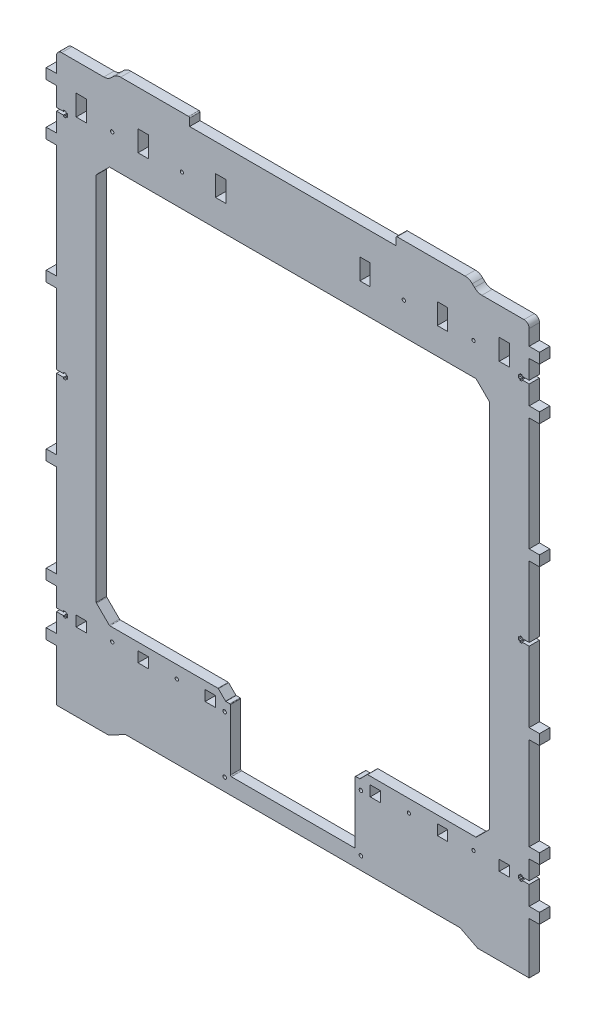
from build123d import *

# Parameters (mm, degrees)
SKETCH_1_R      = 1.6
SKETCH_1_R_2    = 1.7
SKETCH_1_W      = 10
SKETCH_1_H      = 20.1
SKETCH_1_H_2    = 10.1
EXTRUDE_1_DEPTH = 10


with BuildPart() as part:
    # Эскиз1 → Бобышка-Вытянуть1 (new body)
    with BuildSketch(Plane.XY):
        with BuildLine():
            Line((162, -270.3), (179, -279))
            Line((179, -279), (229, -279))
            Line((229, -279), (229, -229.1))
            Line((229, -229.1), (238.998611401, -228.933356477))
            Line((238.998611401, -228.933356477), (238.998611401, -218.933356477))
            Line((238.998611401, -218.933356477), (229, -218.9))
            Line((229, -218.9), (229, -200.55))
            Line((229, -200.55), (222.2, -200.55))
            Line((222.2, -200.55), (222.2, -201.75))
            Line((222.2, -201.75), (220, -201.75))
            Line((220, -201.75), (220, -200.55))
            Line((220, -200.55), (218.5, -200.55))
            Line((218.5, -200.55), (218.5, -197.45))
            Line((218.5, -197.45), (220, -197.45))
            Line((220, -197.45), (220, -196.25))
            Line((220, -196.25), (222.2, -196.25))
            Line((222.2, -196.25), (222.2, -197.45))
            Line((222.2, -197.45), (229, -197.45))
            Line((229, -197.45), (229, -179.1))
            Line((229, -179.1), (238.998611401, -178.933356477))
            Line((238.998611401, -178.933356477), (238.998611401, -168.933356477))
            Line((238.998611401, -168.933356477), (229, -168.9))
            Line((229, -168.9), (229, -79.1))
            Line((229, -79.1), (238.998611401, -78.933356477))
            Line((238.998611401, -78.933356477), (238.998611401, -68.933356477))
            Line((238.998611401, -68.933356477), (229, -68.9))
            Line((229, -68.9), (229, -0.55))
            Line((229, -0.55), (222.2, -0.55))
            Line((222.2, -0.55), (222.2, -1.75))
            Line((222.2, -1.75), (220, -1.75))
            Line((220, -1.75), (220, -0.55))
            Line((220, -0.55), (218.5, -0.55))
            Line((218.5, -0.55), (218.5, 2.55))
            Line((218.5, 2.55), (220, 2.55))
            Line((220, 2.55), (220, 3.75))
            Line((220, 3.75), (222.2, 3.75))
            Line((222.2, 3.75), (222.2, 2.55))
            Line((222.2, 2.55), (229, 2.55))
            Line((229, 2.55), (229, 70.9))
            Line((229, 70.9), (238.998611401, 71.066643523))
            Line((238.998611401, 71.066643523), (238.998611401, 81.066643523))
            Line((238.998611401, 81.066643523), (229, 81.1))
            Line((229, 81.1), (229, 190.9))
            Line((229, 190.9), (238.998611401, 191.066643523))
            Line((238.998611401, 191.066643523), (238.998611401, 201.066643523))
            Line((238.998611401, 201.066643523), (229, 201.1))
            Line((229, 201.1), (229, 219.45))
            Line((229, 219.45), (222.2, 219.45))
            Line((222.2, 219.45), (222.2, 218.25))
            Line((222.2, 218.25), (220, 218.25))
            Line((220, 218.25), (220, 219.45))
            Line((220, 219.45), (218.5, 219.45))
            Line((218.5, 219.45), (218.5, 222.55))
            Line((218.5, 222.55), (220, 222.55))
            Line((220, 222.55), (220, 223.75))
            Line((220, 223.75), (222.2, 223.75))
            Line((222.2, 223.75), (222.2, 222.55))
            Line((222.2, 222.55), (229, 222.55))
            Line((229, 222.55), (229, 240.9))
            Line((229, 240.9), (238.998611401, 241.066643523))
            Line((238.998611401, 241.066643523), (238.998611401, 251.066643523))
            Line((238.998611401, 251.066643523), (229, 251.1))
            Line((229, 251.1), (229, 266))
            ThreePointArc((229, 266), (227.535533906, 269.535533906), (224, 271))
            Line((224, 271), (183.142136, 271))
            ThreePointArc((183.142136, 271), (179.315301597, 271.761204552), (176.071068, 273.928932))
            Line((176.071068, 273.928932), (173.928932, 276.071068))
            ThreePointArc((173.928932, 276.071068), (170.684698403, 278.238795448), (166.857864, 279))
            Line((166.857864, 279), (101, 279))
            ThreePointArc((101, 279), (100.292893219, 278.707106781), (100, 278))
            Line((100, 278), (100, 271))
            Line((100, 271), (-100, 271))
            Line((-100, 271), (-100, 278))
            ThreePointArc((-100, 278), (-100.292893219, 278.707106781), (-101, 279))
            Line((-101, 279), (-166.857864, 279))
            ThreePointArc((-166.857864, 279), (-170.684698403, 278.238795448), (-173.928932, 276.071068))
            Line((-173.928932, 276.071068), (-176.071068, 273.928932))
            ThreePointArc((-176.071068, 273.928932), (-179.315301597, 271.761204552), (-183.142136, 271))
            Line((-183.142136, 271), (-224, 271))
            ThreePointArc((-224, 271), (-227.535533906, 269.535533906), (-229, 266))
            Line((-229, 266), (-229, 251.1))
            Line((-229, 251.1), (-238.998611401, 250.933356477))
            Line((-238.998611401, 250.933356477), (-238.998611401, 240.933356477))
            Line((-238.998611401, 240.933356477), (-229, 240.9))
            Line((-229, 240.9), (-229, 222.55))
            Line((-229, 222.55), (-222.2, 222.55))
            Line((-222.2, 222.55), (-222.2, 223.75))
            Line((-222.2, 223.75), (-220, 223.75))
            Line((-220, 223.75), (-220, 222.55))
            Line((-220, 222.55), (-218.5, 222.55))
            Line((-218.5, 222.55), (-218.5, 219.45))
            Line((-218.5, 219.45), (-220, 219.45))
            Line((-220, 219.45), (-220, 218.25))
            Line((-220, 218.25), (-222.2, 218.25))
            Line((-222.2, 218.25), (-222.2, 219.45))
            Line((-222.2, 219.45), (-229, 219.45))
            Line((-229, 219.45), (-229, 201.1))
            Line((-229, 201.1), (-238.9986114, 200.933356477))
            Line((-238.9986114, 200.933356477), (-238.9986114, 190.933356477))
            Line((-238.9986114, 190.933356477), (-229, 190.9))
            Line((-229, 190.9), (-229, 81.1))
            Line((-229, 81.1), (-238.9986114, 80.933356477))
            Line((-238.9986114, 80.933356477), (-238.9986114, 70.933356477))
            Line((-238.9986114, 70.933356477), (-229, 70.9))
            Line((-229, 70.9), (-229, 2.55))
            Line((-229, 2.55), (-222.2, 2.55))
            Line((-222.2, 2.55), (-222.2, 3.75))
            Line((-222.2, 3.75), (-220, 3.75))
            Line((-220, 3.75), (-220, 2.55))
            Line((-220, 2.55), (-218.5, 2.55))
            Line((-218.5, 2.55), (-218.5, -0.55))
            Line((-218.5, -0.55), (-220, -0.55))
            Line((-220, -0.55), (-220, -1.75))
            Line((-220, -1.75), (-222.2, -1.75))
            Line((-222.2, -1.75), (-222.2, -0.55))
            Line((-222.2, -0.55), (-229, -0.55))
            Line((-229, -0.55), (-229, -68.9))
            Line((-229, -68.9), (-238.9986114, -69.066643523))
            Line((-238.9986114, -69.066643523), (-238.9986114, -79.066643523))
            Line((-238.9986114, -79.066643523), (-229, -79.1))
            Line((-229, -79.1), (-229, -168.9))
            Line((-229, -168.9), (-238.9986114, -169.066643523))
            Line((-238.9986114, -169.066643523), (-238.9986114, -179.066643523))
            Line((-238.9986114, -179.066643523), (-229, -179.1))
            Line((-229, -179.1), (-229, -197.45))
            Line((-229, -197.45), (-222.2, -197.45))
            Line((-222.2, -197.45), (-222.2, -196.25))
            Line((-222.2, -196.25), (-220, -196.25))
            Line((-220, -196.25), (-220, -197.45))
            Line((-220, -197.45), (-218.5, -197.45))
            Line((-218.5, -197.45), (-218.5, -200.55))
            Line((-218.5, -200.55), (-220, -200.55))
            Line((-220, -200.55), (-220, -201.75))
            Line((-220, -201.75), (-222.2, -201.75))
            Line((-222.2, -201.75), (-222.2, -200.55))
            Line((-222.2, -200.55), (-229, -200.55))
            Line((-229, -200.55), (-229, -218.9))
            Line((-229, -218.9), (-238.9986114, -219.066643523))
            Line((-238.9986114, -219.066643523), (-238.9986114, -229.066643523))
            Line((-238.9986114, -229.066643523), (-229, -229.1))
            Line((-229, -229.1), (-229, -279))
            Line((-229, -279), (-179, -279))
            Line((-179, -279), (-162, -270.3))
            Line((-162, -270.3), (162, -270.3))
        make_face()
        with Locations((107.5, 229.05)):
            Circle(SKETCH_1_R, mode=Mode.SUBTRACT)
        with Locations((112.5, -198.952325)):
            Circle(SKETCH_1_R, mode=Mode.SUBTRACT)
        with Locations((-107.5, 229.05)):
            Circle(SKETCH_1_R, mode=Mode.SUBTRACT)
        with Locations((-112.5, -198.952325)):
            Circle(SKETCH_1_R, mode=Mode.SUBTRACT)
        with Locations((-175, -198.952325)):
            Circle(SKETCH_1_R, mode=Mode.SUBTRACT)
        with Locations((175, 229.05)):
            Circle(SKETCH_1_R, mode=Mode.SUBTRACT)
        with Locations((-175, 229.05)):
            Circle(SKETCH_1_R, mode=Mode.SUBTRACT)
        with Locations((175, -198.952325)):
            Circle(SKETCH_1_R, mode=Mode.SUBTRACT)
        with Locations((-66.056409219, -203.102325)):
            Circle(SKETCH_1_R_2, mode=Mode.SUBTRACT)
        with Locations((-66.056409219, -257.902325)):
            Circle(SKETCH_1_R_2, mode=Mode.SUBTRACT)
        with Locations((65.943590781, -257.902325)):
            Circle(SKETCH_1_R_2, mode=Mode.SUBTRACT)
        with Locations((65.943590781, -203.102325)):
            Circle(SKETCH_1_R_2, mode=Mode.SUBTRACT)
        with Locations((-70, 234.05)):
            Rectangle(SKETCH_1_W, SKETCH_1_H, mode=Mode.SUBTRACT)
        with Locations((70, 234.05)):
            Rectangle(SKETCH_1_W, SKETCH_1_H, mode=Mode.SUBTRACT)
        with Locations((-145, 234.05)):
            Rectangle(SKETCH_1_W, SKETCH_1_H, mode=Mode.SUBTRACT)
        with Locations((145, 234.05)):
            Rectangle(SKETCH_1_W, SKETCH_1_H, mode=Mode.SUBTRACT)
        with Locations((-205, 234.05)):
            Rectangle(SKETCH_1_W, SKETCH_1_H, mode=Mode.SUBTRACT)
        with Locations((205, 234.05)):
            Rectangle(SKETCH_1_W, SKETCH_1_H, mode=Mode.SUBTRACT)
        with Locations((-80, -198.952325)):
            Rectangle(SKETCH_1_W, SKETCH_1_H_2, mode=Mode.SUBTRACT)
        with Locations((80, -198.952325)):
            Rectangle(SKETCH_1_W, SKETCH_1_H_2, mode=Mode.SUBTRACT)
        with Locations((145, -198.952325)):
            Rectangle(SKETCH_1_W, SKETCH_1_H_2, mode=Mode.SUBTRACT)
        with Locations((-145, -198.952325)):
            Rectangle(SKETCH_1_W, SKETCH_1_H_2, mode=Mode.SUBTRACT)
        with Locations((-205, -198.952325)):
            Rectangle(SKETCH_1_W, SKETCH_1_H_2, mode=Mode.SUBTRACT)
        with Locations((205, -198.952325)):
            Rectangle(SKETCH_1_W, SKETCH_1_H_2, mode=Mode.SUBTRACT)
        with BuildLine():
            Line((190.419578, -173.414856), (190.419578, 184.955434))
            ThreePointArc((190.419578, 184.955434), (190.342780087, 185.339749118), (190.124182, 185.665035))
            Line((190.124182, 185.665035), (177.830969, 197.871676))
            ThreePointArc((177.830969, 197.871676), (177.507415665, 198.086629268), (177.126365, 198.162075))
            Line((177.126365, 198.162075), (-177.234343, 198.162075))
            ThreePointArc((-177.234343, 198.162075), (-177.615393127, 198.086629077), (-177.938946, 197.871676))
            Line((-177.938946, 197.871676), (-190.23216, 185.665035))
            ThreePointArc((-190.23216, 185.665035), (-190.450758087, 185.339749118), (-190.527556, 184.955434))
            Line((-190.527556, 184.955434), (-190.527556, -173.414857))
            ThreePointArc((-190.527556, -173.414857), (-190.450758087, -173.799172118), (-190.23216, -174.124458))
            Line((-190.23216, -174.124458), (-177.938947, -186.331099))
            ThreePointArc((-177.938947, -186.331099), (-177.615393665, -186.546052268), (-177.234343, -186.621498))
            Line((-177.234343, -186.621498), (-72.544343, -186.621498))
            ThreePointArc((-72.544343, -186.621498), (-72.353001284, -186.659558234), (-72.190789609, -186.767944609))
            Line((-72.190789609, -186.767944609), (-65.202855828, -193.755878391))
            ThreePointArc((-65.202855828, -193.755878391), (-65.040644154, -193.864264766), (-64.849302437, -193.902325))
            Line((-64.849302437, -193.902325), (-61.056409219, -193.902325))
            ThreePointArc((-61.056409219, -193.902325), (-60.702855828, -194.048771609), (-60.556409219, -194.402325))
            Line((-60.556409219, -194.402325), (-60.556409219, -253.402325))
            ThreePointArc((-60.556409219, -253.402325), (-60.263516, -254.109431781), (-59.556409219, -254.402325))
            Line((-59.556409219, -254.402325), (59.443590781, -254.402325))
            ThreePointArc((59.443590781, -254.402325), (60.150697563, -254.109431781), (60.443590781, -253.402325))
            Line((60.443590781, -253.402325), (60.443590781, -194.402325))
            ThreePointArc((60.443590781, -194.402325), (60.590037391, -194.048771609), (60.943590781, -193.902325))
            Line((60.943590781, -193.902325), (64.736484, -193.902325))
            ThreePointArc((64.736484, -193.902325), (64.927825716, -193.864264766), (65.090037391, -193.755878391))
            Line((65.090037391, -193.755878391), (72.077971172, -186.767944609))
            ThreePointArc((72.077971172, -186.767944609), (72.240182846, -186.659558234), (72.431524563, -186.621498))
            Line((72.431524563, -186.621498), (177.126364, -186.621498))
            ThreePointArc((177.126364, -186.621498), (177.507414665, -186.546052268), (177.830968, -186.331099))
            Line((177.830968, -186.331099), (190.124182, -174.124457))
            ThreePointArc((190.124182, -174.124457), (190.342780087, -173.799171118), (190.419578, -173.414856))
        make_face(mode=Mode.SUBTRACT)
    extrude(amount=EXTRUDE_1_DEPTH)


solid = part.part
